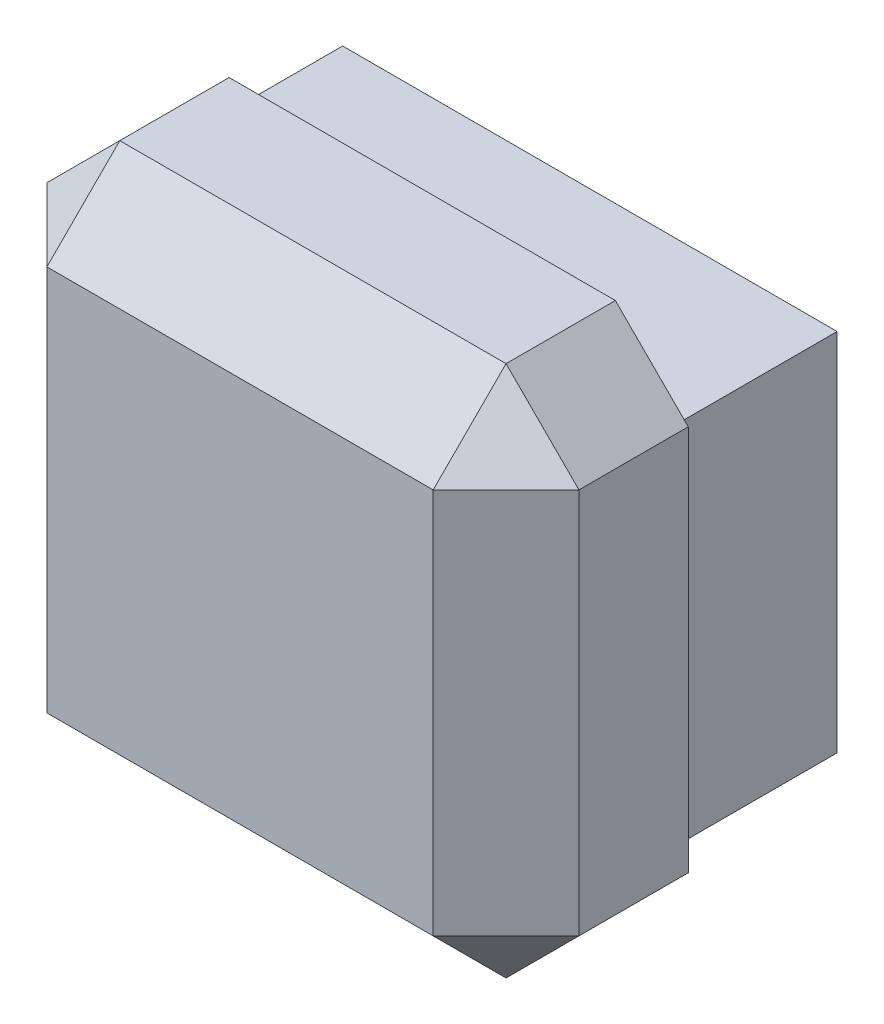
from build123d import *

# Parameters (mm, degrees)
SKETCH1_W           = 6.7846
SKETCH1_H           = 5.0066
SKETCH1_W_2         = 3.8846
SKETCH1_H_2         = 2.1066
BOSS_EXTRUDE1_DEPTH = 2.3
SKETCH2_W           = 7.3
SKETCH2_H           = 7.3
BOSS_EXTRUDE2_DEPTH = 2.5
CHAMFER1_SIZE       = 1
SKETCH3_W           = 3.8846
SKETCH3_H           = 2.1066
CUT_EXTRUDE1_DEPTH  = 1.1


with BuildPart() as part:
    # Sketch1 → Boss-Extrude1 (new body)
    with BuildSketch(Plane.XY):
        Rectangle(SKETCH1_W, SKETCH1_H)
        Rectangle(SKETCH1_W_2, SKETCH1_H_2, mode=Mode.SUBTRACT)
    extrude(amount=-BOSS_EXTRUDE1_DEPTH)

    # Sketch2 → Boss-Extrude2 (add)
    with BuildSketch(Plane.XY):
        Rectangle(SKETCH2_W, SKETCH2_H)
    extrude(amount=BOSS_EXTRUDE2_DEPTH)

    # Chamfer1
    chamfer1_edges = [part.edges().sort_by_distance(p)[0] for p in [
        (3.65, -3.65, 1.25),
        (3.65, 3.65, 1.25),
        (-3.65, 3.65, 1.25),
        (-3.65, -3.65, 1.25),
        (3.65, 0, 2.5),
        (0, 3.65, 2.5),
        (-3.65, 0, 2.5),
        (0, -3.65, 2.5),
    ]]
    chamfer(chamfer1_edges, length=CHAMFER1_SIZE)

    # Sketch3 → Cut-Extrude1 (cut)
    with BuildSketch(Plane(origin=(0, 0, 0), x_dir=(-1, 0, 0), z_dir=(0, 0, -1))):
        Rectangle(SKETCH3_W, SKETCH3_H)
    extrude(amount=-CUT_EXTRUDE1_DEPTH, mode=Mode.SUBTRACT)


solid = part.part
